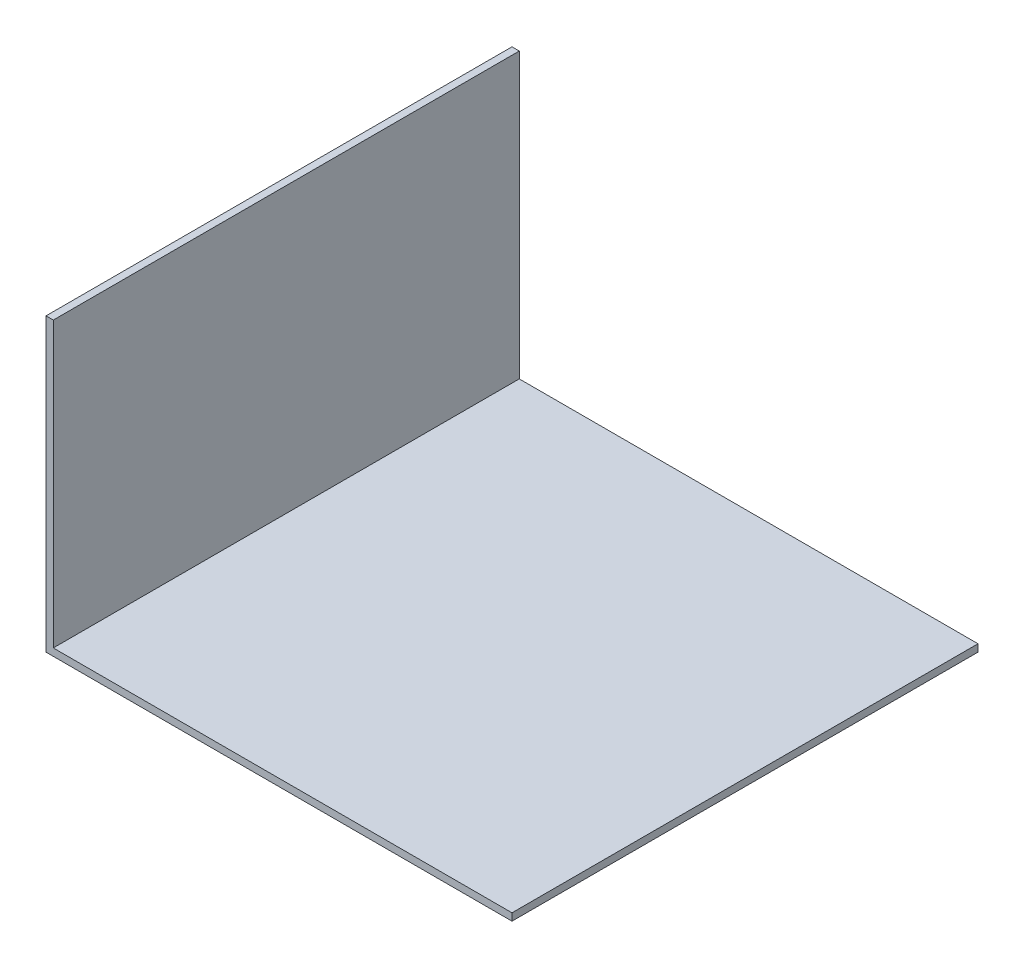
from build123d import *

# Parameters (mm, degrees)
BOSS_EXTRUDE1_DEPTH = 203.2


with BuildPart() as part:
    # Sketch2 → Boss-Extrude1 (new body)
    with BuildSketch(Plane.XY):
        Polygon((21.113251485, 148.785646973), (21.113251485, 21.785646973), (224.313251485, 21.785646973), (224.313251485, 24.960646973), (24.288251485, 24.960646973), (24.288251485, 148.785646973), align=None)
    extrude(amount=BOSS_EXTRUDE1_DEPTH)


solid = part.part
